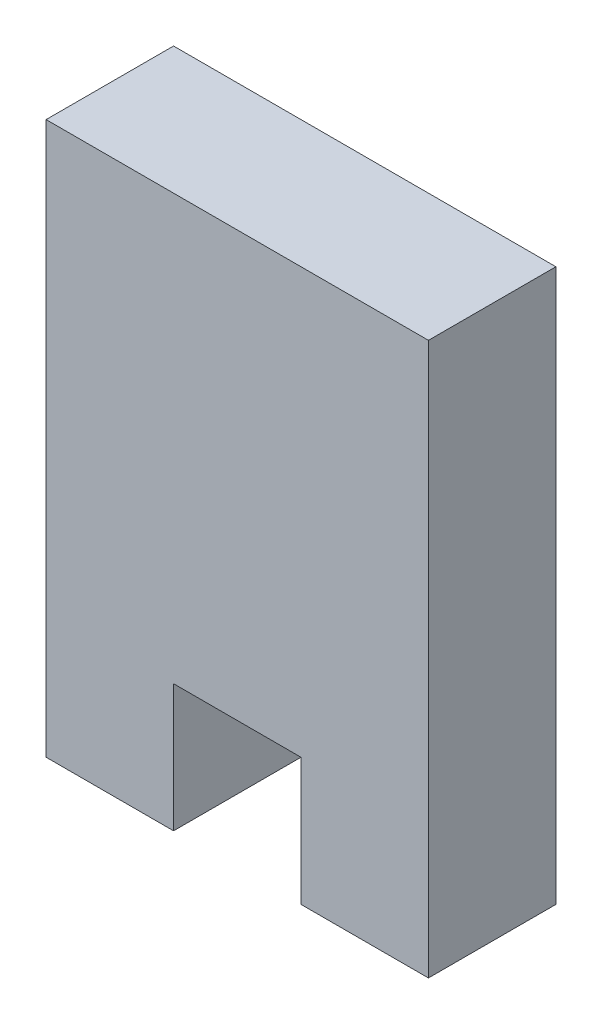
from build123d import *

# Parameters (mm, degrees)
BOSS_EXTRUDE1_DEPTH = 3


with BuildPart() as part:
    # Sketch1 → Boss-Extrude1 (new body)
    with BuildSketch(Plane.XY):
        Polygon((-4.581635068, -20.341779987), (-1.581635068, -20.341779987), (-1.581635068, -7.341779987), (-10.581635068, -7.341779987), (-10.581635068, -20.341779987), (-7.581635068, -20.341779987), (-7.581635068, -17.341779987), (-4.581635068, -17.341779987), align=None)
    extrude(amount=BOSS_EXTRUDE1_DEPTH)


solid = part.part
